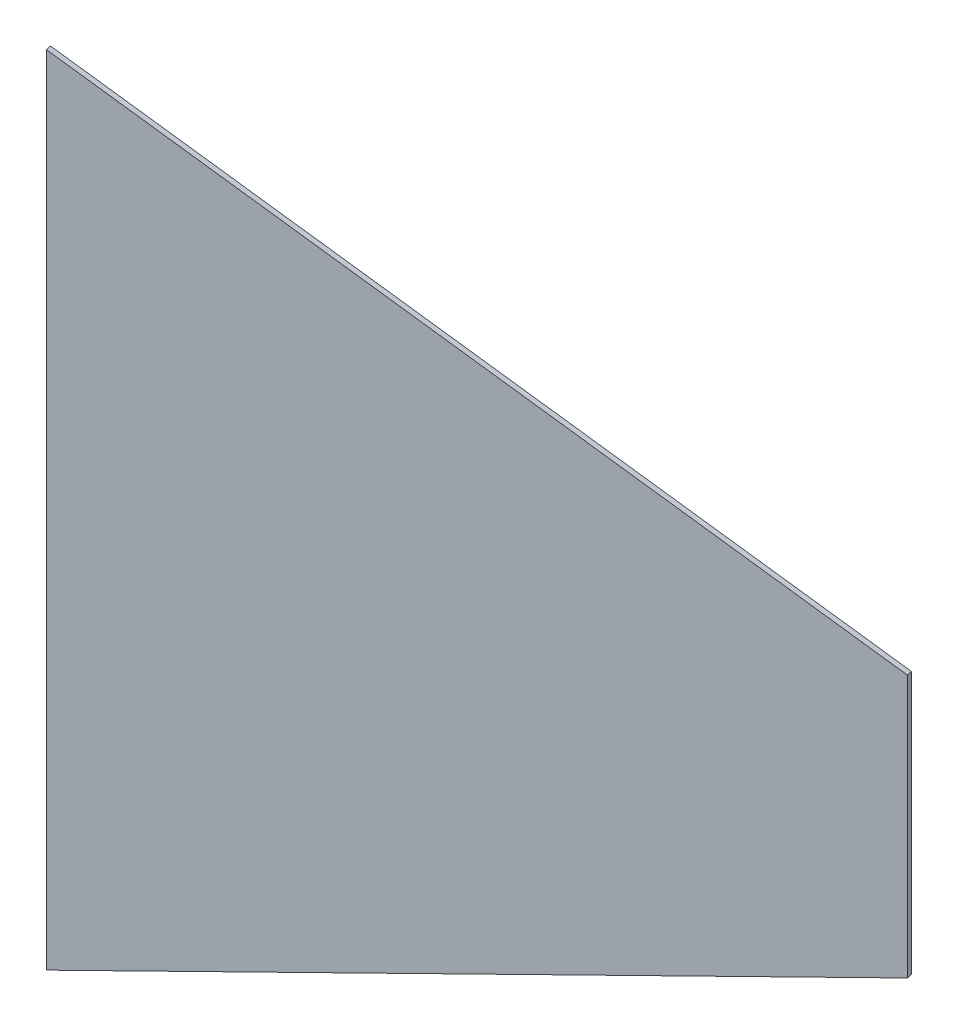
from build123d import *

# Parameters (mm, degrees)
BOSS_EXTRUDE1_DEPTH = 3.175


with BuildPart() as part:
    # Sketch1 → Boss-Extrude1 (new body)
    with BuildSketch(Plane(origin=(161.017557723, 0, 726.303266861), x_dir=(0, 1, 0), z_dir=(0.2164396139381031, 0, 0.9762960071199334))):
        Polygon((236.803396725, 530.4552833), (-236.803396725, 530.4552833), (-77.912051321, 101.6), (77.912051321, 101.6), align=None)
    extrude(amount=-BOSS_EXTRUDE1_DEPTH)


solid = part.part
